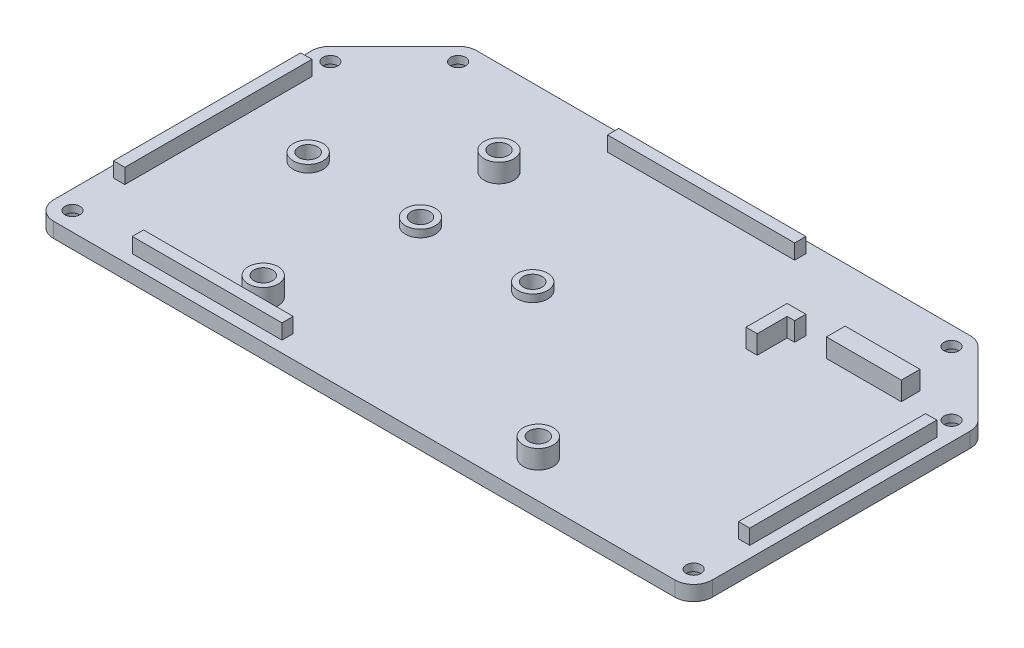
from build123d import *

# Parameters (mm, degrees)
BOSS_EXTRUDE1_DEPTH = 4
SKETCH10_R          = 4
SKETCH10_R_2        = 2.5
SKETCH10_W          = 20
SKETCH10_H          = 5
BOSS_EXTRUDE5_DEPTH = 5
SKETCH11_W          = 3
SKETCH11_H          = 50
SKETCH11_W_2        = 40
SKETCH11_H_2        = 3
BOSS_EXTRUDE6_DEPTH = 4
SKETCH12_R          = 2.5
CUT_EXTRUDE5_DEPTH  = 4
BOSS_EXTRUDE7_START = 2
SKETCH13_R          = 4
SKETCH13_R_2        = 2.5
BOSS_EXTRUDE7_DEPTH = 2
SKETCH14_R          = 2
CUT_EXTRUDE6_DEPTH  = 15
SKETCH15_R          = 3.5
CUT_EXTRUDE8_DEPTH  = 2
FILLET1_R           = 5


with BuildPart() as part:
    # Sketch1 → Boss-Extrude1 (new body)
    with BuildSketch(Plane(origin=(0, 0, 0), x_dir=(1, 0, 0), z_dir=(0, 1, 0))):
        Polygon((-68, 48), (-88, 28), (-88, -48), (88, -48), (88, 28), (68, 48), align=None)
    extrude(amount=BOSS_EXTRUDE1_DEPTH)

    # Sketch10 → Boss-Extrude5 (add)
    # profile 1 of 5: a face of its own
    with BuildSketch(Plane(origin=(0, 4, 0), x_dir=(1, 0, 0), z_dir=(0, 1, 0))):
        with Locations(Location((36.5, -38, 0), (0, 0, 270))):
            Circle(SKETCH10_R)
        with Locations(Location((36.5, -38, 0), (0, 0, 270))):
            Circle(SKETCH10_R_2, mode=Mode.SUBTRACT)
    # profile 2 of 5: a face of its own
    with BuildSketch(Plane(origin=(0, 4, 0), x_dir=(1, 0, 0), z_dir=(0, 1, 0))):
        with Locations(Location((-37.5, -37.5, 0), (0, 0, 270))):
            Circle(SKETCH10_R)
        with Locations(Location((-37.5, -37.5, 0), (0, 0, 270))):
            Circle(SKETCH10_R_2, mode=Mode.SUBTRACT)
    # profile 3 of 5: a face of its own
    with BuildSketch(Plane(origin=(0, 4, 0), x_dir=(1, 0, 0), z_dir=(0, 1, 0))):
        with Locations(Location((-35, 23, 0), (0, 0, 270))):
            Circle(SKETCH10_R)
        with Locations(Location((-35, 23, 0), (0, 0, 270))):
            Circle(SKETCH10_R_2, mode=Mode.SUBTRACT)
    # profile 4 of 5: a face of its own
    with BuildSketch(Plane(origin=(0, 4, 0), x_dir=(1, 0, 0), z_dir=(0, 1, 0))):
        with Locations((62, 26)):
            Rectangle(SKETCH10_W, SKETCH10_H)
    # profile 5 of 5: a face of its own
    with BuildSketch(Plane(origin=(0, 4, 0), x_dir=(1, 0, 0), z_dir=(0, 1, 0))):
        Polygon((42, 23), (42, 15), (39, 15), (39, 26), (44, 26), (44, 23), align=None)
    extrude(amount=BOSS_EXTRUDE5_DEPTH)

    # Sketch11 → Boss-Extrude6 (add)
    with BuildSketch(Plane(origin=(0, 4, 0), x_dir=(1, 0, 0), z_dir=(0, 1, 0))):
        Polygon((25, 43.5), (25, 45), (-25, 45), (-25, 43.5), (-25, 42), (25, 42), align=None)
        Polygon((-82, 20), (-83.5, 20), (-85, 20), (-85, -30), (-82, -30), align=None)
        with Locations((83.5, -5)):
            Rectangle(SKETCH11_W, SKETCH11_H)
        with Locations((-45, -43.5)):
            Rectangle(SKETCH11_W_2, SKETCH11_H_2)
    extrude(amount=BOSS_EXTRUDE6_DEPTH)

    # Sketch12 → Cut-Extrude5 (cut)
    with BuildSketch(Plane(origin=(0, 4, 0), x_dir=(1, 0, 0), z_dir=(0, 1, 0))):
        with Locations(Location((-63, 0, 0), (0, 0, 270))):
            Circle(SKETCH12_R)
        with Locations(Location((-33, 0, 0), (0, 0, 270))):
            Circle(SKETCH12_R)
        with Locations(Location((-3, 0, 0), (0, 0, 270))):
            Circle(SKETCH12_R)
    extrude(amount=-CUT_EXTRUDE5_DEPTH, mode=Mode.SUBTRACT)

    # Sketch13 → Boss-Extrude7 (add)
    # profile 1 of 3: a face of its own
    with BuildSketch(Plane(origin=(0, 4, 0), x_dir=(1, 0, 0), z_dir=(0, 1, 0)).offset(BOSS_EXTRUDE7_START)):
        with Locations(Location((-63, 0, 0), (0, 0, 270))):
            Circle(SKETCH13_R)
        with Locations(Location((-63, 0, 0), (0, 0, 270))):
            Circle(SKETCH13_R_2, mode=Mode.SUBTRACT)
    # profile 2 of 3: a face of its own
    with BuildSketch(Plane(origin=(0, 4, 0), x_dir=(1, 0, 0), z_dir=(0, 1, 0)).offset(BOSS_EXTRUDE7_START)):
        with Locations(Location((-33, 0, 0), (0, 0, 270))):
            Circle(SKETCH13_R)
        with Locations(Location((-33, 0, 0), (0, 0, 270))):
            Circle(SKETCH13_R_2, mode=Mode.SUBTRACT)
    # profile 3 of 3: a face of its own
    with BuildSketch(Plane(origin=(0, 4, 0), x_dir=(1, 0, 0), z_dir=(0, 1, 0)).offset(BOSS_EXTRUDE7_START)):
        with Locations(Location((-3, 0, 0), (0, 0, 270))):
            Circle(SKETCH13_R)
        with Locations(Location((-3, 0, 0), (0, 0, 270))):
            Circle(SKETCH13_R_2, mode=Mode.SUBTRACT)
    extrude(amount=-BOSS_EXTRUDE7_DEPTH)

    # Sketch14 → Cut-Extrude6 (cut)
    with BuildSketch(Plane(origin=(0, 4, 0), x_dir=(1, 0, 0), z_dir=(0, 1, 0))):
        with Locations(Location((-65.928932188, 43, 0), (0, 0, 270))):
            Circle(SKETCH14_R)
        with Locations(Location((-83, 25.928932188, 0), (0, 0, 270))):
            Circle(SKETCH14_R)
        with Locations(Location((-83, -43, 0), (0, 0, 270))):
            Circle(SKETCH14_R)
        with Locations(Location((65.928932188, 43, 0), (0, 0, 270))):
            Circle(SKETCH14_R)
        with Locations(Location((83, 25.928932188, 0), (0, 0, 270))):
            Circle(SKETCH14_R)
        with Locations(Location((83, -43, 0), (0, 0, 270))):
            Circle(SKETCH14_R)
    extrude(amount=-CUT_EXTRUDE6_DEPTH, mode=Mode.SUBTRACT)

    # Sketch15 → Cut-Extrude8 (cut)
    with BuildSketch(Plane.XZ):
        with Locations(Location((-83, 43, 0), (0, 0, 270))):
            Circle(SKETCH15_R)
        with Locations(Location((-83, -25.928932188, 0), (0, 0, 270))):
            Circle(SKETCH15_R)
        with Locations(Location((-65.928932188, -43, 0), (0, 0, 270))):
            Circle(SKETCH15_R)
        with Locations(Location((65.928932188, -43, 0), (0, 0, 90))):
            Circle(SKETCH15_R)
        with Locations(Location((83, -25.928932188, 0), (0, 0, 90))):
            Circle(SKETCH15_R)
        with Locations(Location((83, 43, 0), (0, 0, 90))):
            Circle(SKETCH15_R)
    extrude(amount=-CUT_EXTRUDE8_DEPTH, mode=Mode.SUBTRACT)

    # Fillet1
    fillet1_edges = [part.edges().sort_by_distance(p)[0] for p in [
        (88, 2, 48),
        (-88, 2, 48),
        (-88, 2, -28),
        (-68, 2, -48),
        (68, 2, -48),
        (88, 2, -28),
    ]]
    fillet(fillet1_edges, radius=FILLET1_R)


solid = part.part
